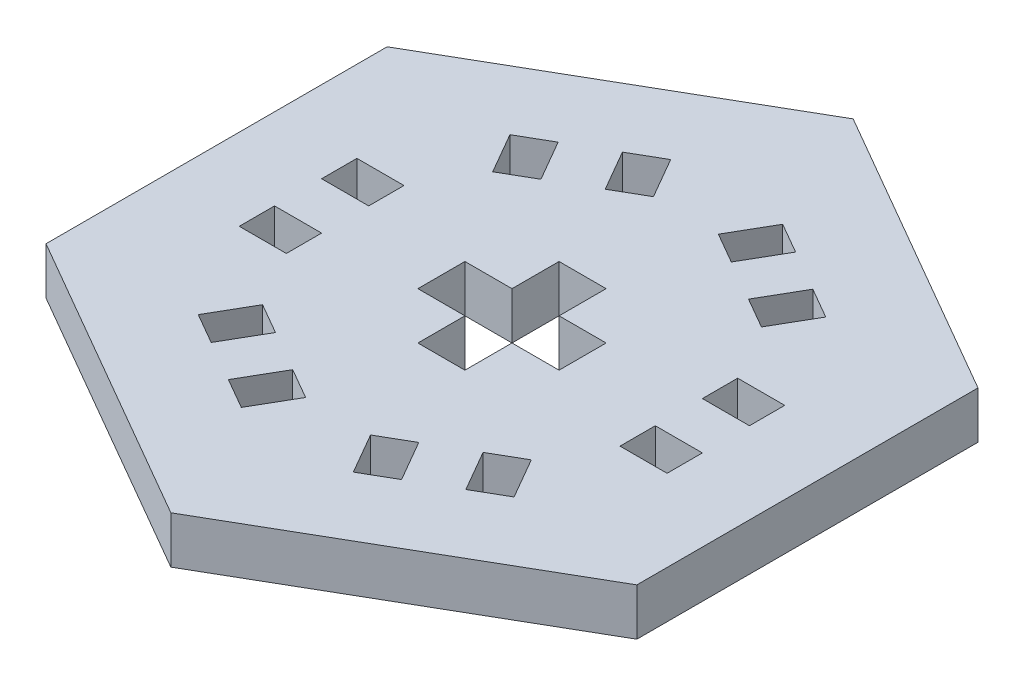
from build123d import *

# Parameters (mm, degrees)
SKETCH1_W           = 5.08
SKETCH1_H           = 3.81
BOSS_EXTRUDE1_DEPTH = 5.08
CUT_EXTRUDE1_DEPTH  = 5.08


with BuildPart() as part:
    # Sketch1 → Boss-Extrude1 (new body)
    with BuildSketch(Plane(origin=(0, 0, 0), x_dir=(1, 0, 0), z_dir=(0, 1, 0))):
        Polygon((-41.626929972, -5.1367648), (-9.740013168, -23.5466848), (22.146903635, -5.1367648), (22.146903635, 31.6830752), (-9.740013168, 50.0929952), (-41.626929972, 31.6830752), align=None)
        Polygon((-15.784801205, 36.4430352), (-13.244801205, 32.043626149), (-16.544357993, 30.138626149), (-19.084357993, 34.5380352), align=None, mode=Mode.SUBTRACT)
        with Locations((-30.288111869, 17.7181552)):
            Rectangle(SKETCH1_W, SKETCH1_H, mode=Mode.SUBTRACT)
        with Locations((-30.288111869, 8.8281552)):
            Rectangle(SKETCH1_W, SKETCH1_H, mode=Mode.SUBTRACT)
        Polygon((-26.783323833, 30.0930352), (-24.243323833, 25.693626149), (-20.943767044, 27.598626149), (-23.483767044, 31.9980352), align=None, mode=Mode.SUBTRACT)
        Polygon((7.303297496, 30.0930352), (4.763297496, 25.693626149), (1.463740708, 27.598626149), (4.003740708, 31.9980352), align=None, mode=Mode.SUBTRACT)
        Polygon((-3.695225132, 36.4430352), (-6.235225132, 32.043626149), (-2.935668344, 30.138626149), (-0.395668344, 34.5380352), align=None, mode=Mode.SUBTRACT)
        with Locations((10.808085532, 8.8281552)):
            Rectangle(SKETCH1_W, SKETCH1_H, mode=Mode.SUBTRACT)
        with Locations((10.808085532, 17.7181552)):
            Rectangle(SKETCH1_W, SKETCH1_H, mode=Mode.SUBTRACT)
        Polygon((-3.695225132, -9.8967248), (-6.235225132, -5.497315749), (-2.935668344, -3.592315749), (-0.395668344, -7.9917248), align=None, mode=Mode.SUBTRACT)
        Polygon((7.303297496, -3.5467248), (4.763297496, 0.852684251), (1.463740708, -1.052315749), (4.003740708, -5.4517248), align=None, mode=Mode.SUBTRACT)
        Polygon((-26.783323833, -3.5467248), (-24.243323833, 0.852684251), (-20.943767044, -1.052315749), (-23.483767044, -5.4517248), align=None, mode=Mode.SUBTRACT)
        Polygon((-15.784801205, -9.8967248), (-13.244801205, -5.497315749), (-16.544357993, -3.592315749), (-19.084357993, -7.9917248), align=None, mode=Mode.SUBTRACT)
    extrude(amount=BOSS_EXTRUDE1_DEPTH)

    # Sketch2 → Cut-Extrude1 (cut)
    with BuildSketch(Plane(origin=(0, 5.08, 0), x_dir=(1, 0, 0), z_dir=(0, 1, 0))):
        Polygon((-12.280013168, 20.8931552), (-9.740013168, 20.8931552), (-7.200013168, 20.8931552), (-7.200013168, 15.8131552), (-2.120013168, 15.8131552), (-2.120013168, 13.2731552), (-2.120013168, 10.7331552), (-7.200013168, 10.7331552), (-7.200013168, 5.6531552), (-9.740013168, 5.6531552), (-12.280013168, 5.6531552), (-12.280013168, 10.7331552), (-17.360013168, 10.7331552), (-17.360013168, 13.2731552), (-17.360013168, 15.8131552), (-12.280013168, 15.8131552), align=None)
    extrude(amount=-CUT_EXTRUDE1_DEPTH, mode=Mode.SUBTRACT)


solid = part.part
